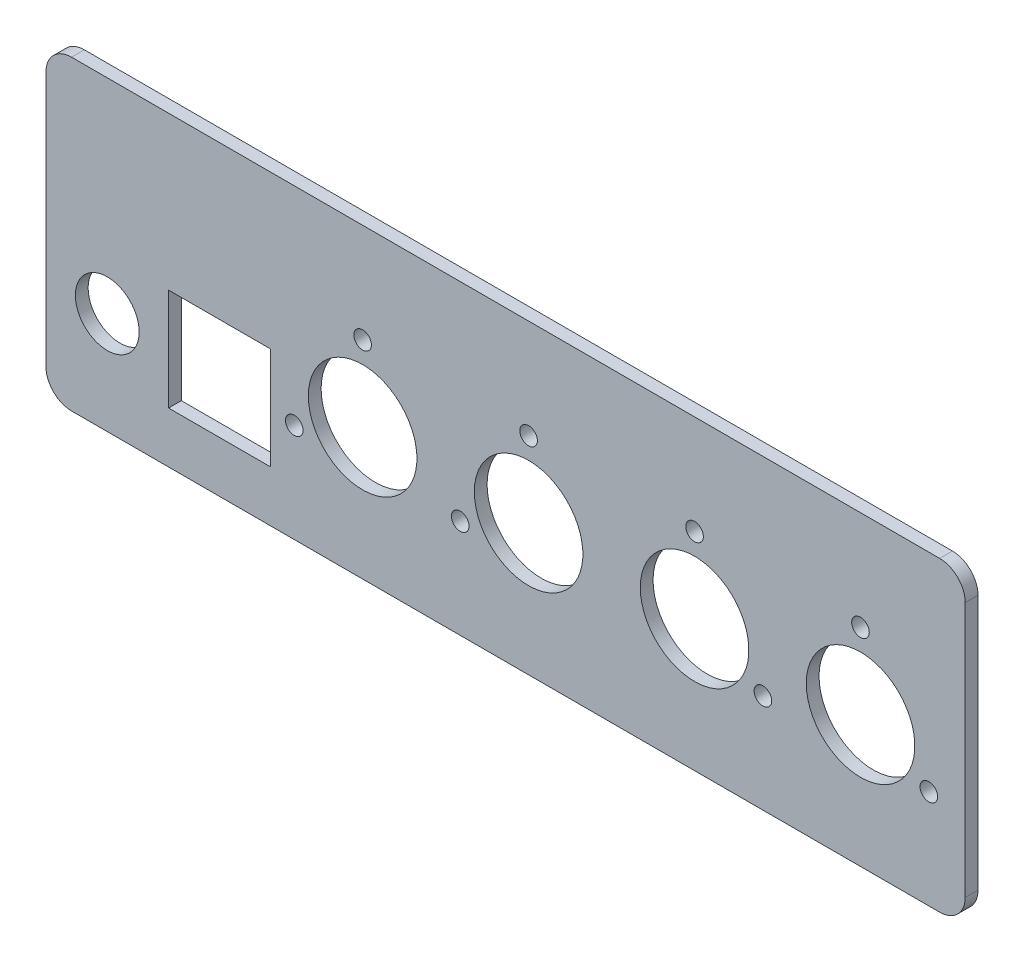
from build123d import *

# Parameters (mm, degrees)
BOSS_EXTRUDE1_DEPTH = 1.5875
SKETCH2_R           = 6.74878
SKETCH2_R_2         = 3.96875
SKETCH2_W           = 12.7
SKETCH2_H           = 12.7
CUT_EXTRUDE1_DEPTH  = 1.5875
SKETCH3_R           = 1.0922
CUT_EXTRUDE2_DEPTH  = 64.189671282


with BuildPart() as part:
    # Sketch1 → Boss-Extrude1 (new body)
    with BuildSketch(Plane.XY):
        with BuildLine():
            Line((-52.840313991, 24.357951008), (55.109686009, 24.357951008))
            ThreePointArc((55.109686009, 24.357951008), (57.354750039, 23.428015038), (58.284686009, 21.182951008))
            Line((58.284686009, 21.182951008), (58.284686009, -10.567048992))
            ThreePointArc((58.284686009, -10.567048992), (57.354750039, -12.812113022), (55.109686009, -13.742048992))
            Line((55.109686009, -13.742048992), (-52.840313991, -13.742048992))
            ThreePointArc((-52.840313991, -13.742048992), (-55.085378022, -12.812113022), (-56.015313991, -10.567048992))
            Line((-56.015313991, -10.567048992), (-56.015313991, 21.182951008))
            ThreePointArc((-56.015313991, 21.182951008), (-55.085378022, 23.428015038), (-52.840313991, 24.357951008))
        make_face()
    extrude(amount=BOSS_EXTRUDE1_DEPTH)

    # Sketch2 → Cut-Extrude1 (cut)
    with BuildSketch(Plane(origin=(0, 0, 0), x_dir=(-1, 0, 0), z_dir=(0, 0, -1))):
        with Locations((16.645313991, 2.607931008)):
            Circle(SKETCH2_R)
        with Locations((-3.992186009, 2.607931008)):
            Circle(SKETCH2_R)
        with Locations((-24.629686009, 2.607931008)):
            Circle(SKETCH2_R)
        with Locations((-45.267186009, 2.607931008)):
            Circle(SKETCH2_R)
        with Locations((48.395313991, -1.042048992)):
            Circle(SKETCH2_R_2)
        with Locations((34.425313991, -1.042048992)):
            Rectangle(SKETCH2_W, SKETCH2_H)
    extrude(amount=-CUT_EXTRUDE1_DEPTH, mode=Mode.SUBTRACT)

    # Sketch3 → Cut-Extrude2 (cut, through all)
    with BuildSketch(Plane.XY.offset(1.5875)):
        with Locations((-16.645313991, 12.00793098)):
            Circle(SKETCH3_R)
        with Locations((3.989686009, 12.00793098)):
            Circle(SKETCH3_R)
        with Locations((24.624686009, 12.00793098)):
            Circle(SKETCH3_R)
        with Locations((-25.145314009, -1.44206902)):
            Circle(SKETCH3_R)
        with Locations((-4.510314009, -1.44206902)):
            Circle(SKETCH3_R)
        with Locations((33.124685991, -1.44206902)):
            Circle(SKETCH3_R)
        with Locations((45.259686009, 12.00793098)):
            Circle(SKETCH3_R)
        with Locations((53.759685991, -1.44206902)):
            Circle(SKETCH3_R)
    extrude(amount=-CUT_EXTRUDE2_DEPTH, mode=Mode.SUBTRACT)


solid = part.part
